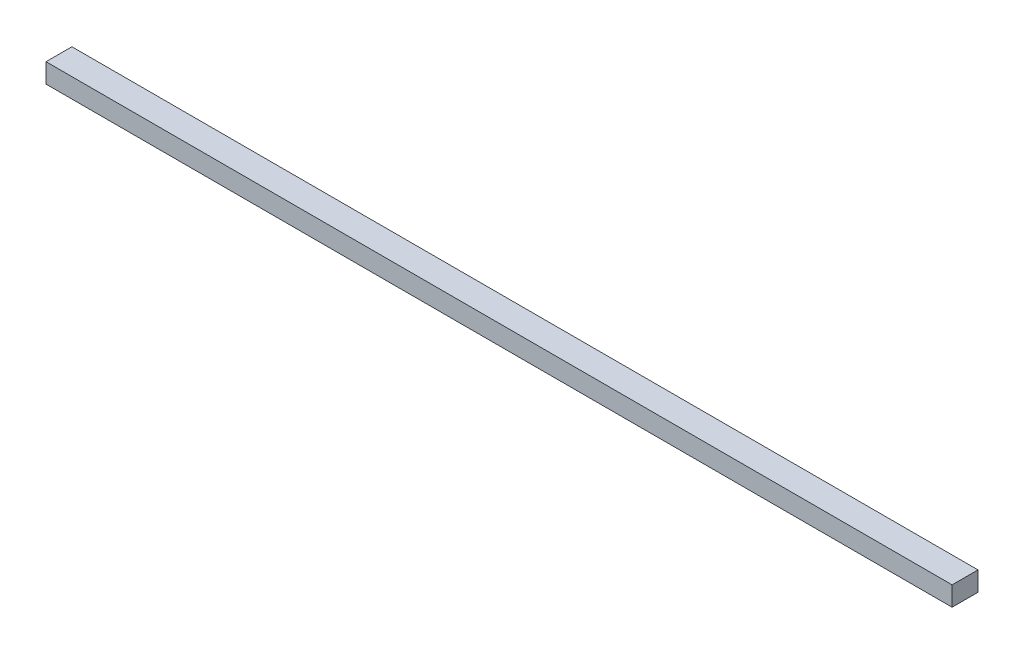
from build123d import *

# Parameters (mm, degrees)
SKETCH1_W           = 280
SKETCH1_H           = 8
BOSS_EXTRUDE1_DEPTH = 6


with BuildPart() as part:
    # Sketch1 → Boss-Extrude1 (new body)
    with BuildSketch(Plane(origin=(0, 0, 0), x_dir=(1, 0, 0), z_dir=(0, 1, 0))):
        Rectangle(SKETCH1_W, SKETCH1_H)
    extrude(amount=BOSS_EXTRUDE1_DEPTH)


solid = part.part
